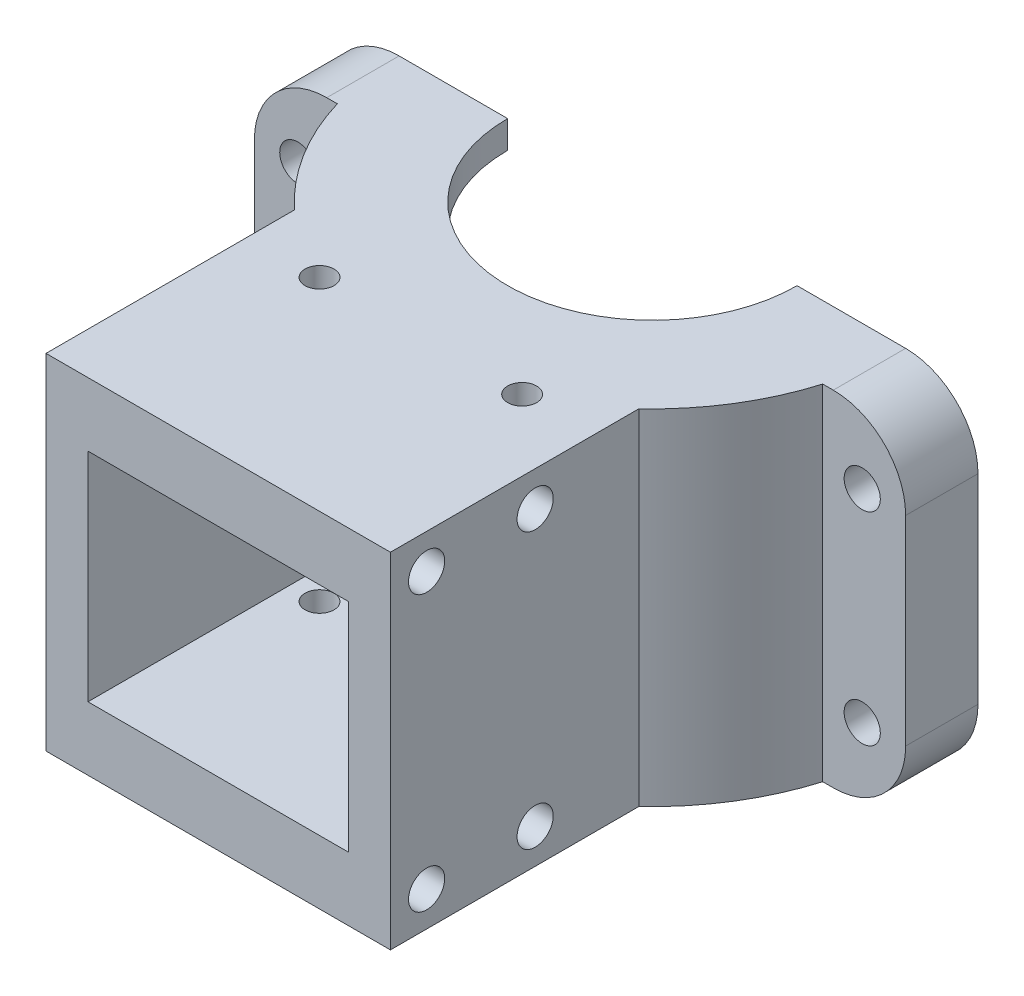
from build123d import *

# Parameters (mm, degrees)
CROQUIS1_W              = 47.6
CROQUIS1_H              = 47.6
SALIENTE_EXTRUIR1_DEPTH = 40
CROQUIS3_R              = 35
SALIENTE_EXTRUIR2_DEPTH = 47.6
CROQUIS4_W              = 80
CROQUIS4_H              = 40
CORTAR_EXTRUIR1_DEPTH   = 81.72025768
CROQUIS9_W              = 90
CROQUIS9_H              = 10
SALIENTE_EXTRUIR3_DEPTH = 47.6
CORTAR_EXTRUIR2_START   = -3.8
CROQUIS5_R              = 27.5
CORTAR_EXTRUIR2_DEPTH   = 37
CROQUIS6_W              = 36
CROQUIS6_H              = 30
CORTAR_EXTRUIR3_DEPTH   = 79.685703911
CORTAR_EXTRUIR4_START   = 10
CROQUIS7_R              = 30
CORTAR_EXTRUIR4_DEPTH   = 17
CROQUIS8_R              = 2.5
CORTAR_EXTRUIR5_DEPTH   = 84.065516311
CROQUIS11_R             = 2.5
CORTAR_EXTRUIR7_DEPTH   = 79.685703911
REDONDEO1_R             = 10
CROQUIS10_R             = 20
CORTAR_EXTRUIR6_DEPTH   = 77.751286634
CROQUIS13_R             = 2
CORTAR_EXTRUIR8_DEPTH   = 77.751286634
CROQUIS14_R             = 6
SALIENTE_EXTRUIR4_DEPTH = 1.2
CROQUIS15_R             = 1.5
CORTAR_EXTRUIR9_DEPTH   = 8


with BuildPart() as part:
    # Croquis1 → Saliente-Extruir1 (new body)
    with BuildSketch(Plane.XY):
        Rectangle(CROQUIS1_W, CROQUIS1_H)
    extrude(amount=SALIENTE_EXTRUIR1_DEPTH)

    # Croquis3 → Saliente-Extruir2 (add)
    with BuildSketch(Plane(origin=(0, 23.8, 0), x_dir=(1, 0, 0), z_dir=(0, 1, 0))):
        with Locations((0, 20)):
            Circle(CROQUIS3_R)
    extrude(amount=-SALIENTE_EXTRUIR2_DEPTH)

    # Croquis4 → Cortar-Extruir1 (cut, through all)
    with BuildSketch(Plane(origin=(0, 23.8, 0), x_dir=(1, 0, 0), z_dir=(0, 1, 0))):
        with Locations((0.60144352, 40)):
            Rectangle(CROQUIS4_W, CROQUIS4_H)
    extrude(amount=-CORTAR_EXTRUIR1_DEPTH, mode=Mode.SUBTRACT)

    # Croquis9 → Saliente-Extruir3 (add)
    with BuildSketch(Plane.XZ.offset(23.8)):
        with Locations((0, -15)):
            Rectangle(CROQUIS9_W, CROQUIS9_H)
    extrude(amount=-SALIENTE_EXTRUIR3_DEPTH)

    # Croquis5 → Cortar-Extruir2 (cut)
    with BuildSketch(Plane(origin=(0, 23.8, 0), x_dir=(1, 0, 0), z_dir=(0, 1, 0)).offset(CORTAR_EXTRUIR2_START)):
        with Locations((0, 20)):
            Circle(CROQUIS5_R)
    extrude(amount=-CORTAR_EXTRUIR2_DEPTH, mode=Mode.SUBTRACT)

    # Croquis6 → Cortar-Extruir3 (cut, through all)
    with BuildSketch(Plane.XY.offset(40)):
        Rectangle(CROQUIS6_W, CROQUIS6_H)
    extrude(amount=-CORTAR_EXTRUIR3_DEPTH, mode=Mode.SUBTRACT)

    # Croquis7 → Cortar-Extruir4 (cut)
    with BuildSketch(Plane.XZ.offset(-20).offset(CORTAR_EXTRUIR4_START)):
        with Locations((0, -20)):
            Circle(CROQUIS7_R)
    extrude(amount=CORTAR_EXTRUIR4_DEPTH, mode=Mode.SUBTRACT)

    # Croquis8 → Cortar-Extruir5 (cut, through all)
    with BuildSketch(Plane(origin=(23.8, 0, 0), x_dir=(0, 0, -1), z_dir=(1, 0, 0))):
        with Locations(Location((-35, 19, 0), (0, 0, 90))):
            Circle(CROQUIS8_R)
        with Locations(Location((-20, 19, 0), (0, 0, 90))):
            Circle(CROQUIS8_R)
        with Locations(Location((-20, -19, 0), (0, 0, 90))):
            Circle(CROQUIS8_R)
        with Locations(Location((-35, -19, 0), (0, 0, 90))):
            Circle(CROQUIS8_R)
    extrude(amount=-CORTAR_EXTRUIR5_DEPTH, mode=Mode.SUBTRACT)

    # Croquis11 → Cortar-Extruir7 (cut, through all)
    with BuildSketch(Plane(origin=(0, 0, -20), x_dir=(-1, 0, 0), z_dir=(0, 0, -1))):
        with Locations((39, 14)):
            Circle(CROQUIS11_R)
        with Locations(Location((39, -14, 0), (0, 0, 180))):
            Circle(CROQUIS11_R)
        with Locations((-39, -14)):
            Circle(CROQUIS11_R)
        with Locations(Location((-39, 14, 0), (0, 0, 180))):
            Circle(CROQUIS11_R)
    extrude(amount=-CORTAR_EXTRUIR7_DEPTH, mode=Mode.SUBTRACT)

    # Redondeo1
    redondeo1_edges = [part.edges().sort_by_distance(p)[0] for p in [
        (45, -23.8, -15),
        (-45, 23.8, -15),
        (45, 23.8, -15),
        (-45, -23.8, -15),
    ]]
    fillet(redondeo1_edges, radius=REDONDEO1_R)

    # Croquis10 → Cortar-Extruir6 (cut, through all)
    with BuildSketch(Plane(origin=(0, 23.8, 0), x_dir=(1, 0, 0), z_dir=(0, 1, 0))):
        with Locations((0, 20)):
            Circle(CROQUIS10_R)
    extrude(amount=-CORTAR_EXTRUIR6_DEPTH, mode=Mode.SUBTRACT)

    # Croquis13 → Cortar-Extruir8 (cut, through all)
    with BuildSketch(Plane(origin=(0, 23.8, 0), x_dir=(1, 0, 0), z_dir=(0, 1, 0))):
        with Locations(Location((-14, -12, 0), (0, 0, 270))):
            Circle(CROQUIS13_R)
        with Locations(Location((14, -12, 0), (0, 0, 270))):
            Circle(CROQUIS13_R)
    extrude(amount=-CORTAR_EXTRUIR8_DEPTH, mode=Mode.SUBTRACT)

    # Croquis14 → Saliente-Extruir4 (add)
    with BuildSketch(Plane.XZ.offset(23.8)):
        with Locations(Location((-18.738329701, -1.261670299, 0), (0, 0, 90))):
            Circle(CROQUIS14_R)
        with Locations(Location((18.738329701, -1.261670299, 0), (0, 0, 90))):
            Circle(CROQUIS14_R)
    extrude(amount=SALIENTE_EXTRUIR4_DEPTH)

    # Croquis15 → Cortar-Extruir9 (cut)
    with BuildSketch(Plane.XZ.offset(25)):
        with Locations(Location((18.738329701, -1.261670299, 0), (0, 0, 270))):
            Circle(CROQUIS15_R)
        with Locations(Location((-18.738329701, -1.261670299, 0), (0, 0, 270))):
            Circle(CROQUIS15_R)
    extrude(amount=-CORTAR_EXTRUIR9_DEPTH, mode=Mode.SUBTRACT)


solid = part.part
